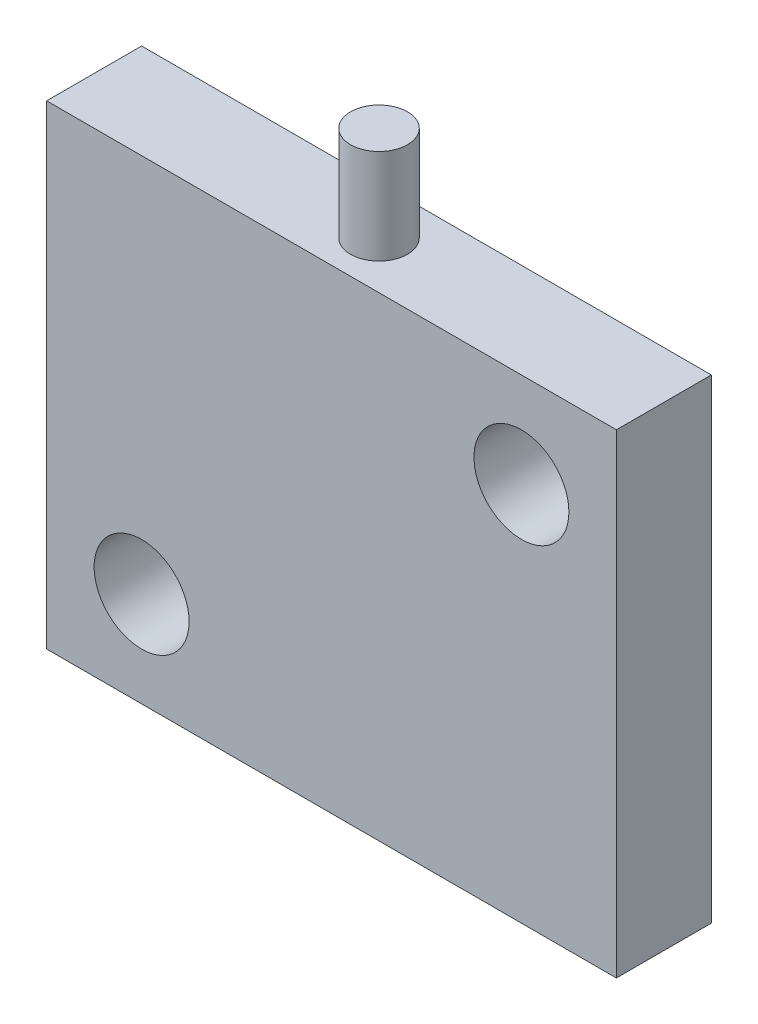
from build123d import *

# Parameters (mm, degrees)
SKETCH_1_W          = 60
SKETCH_1_H          = 60
EXTRUDE_1_DEPTH     = 10
SKETCH_2_W          = 60
SKETCH_2_H          = 10
SKETCH_2_R          = 3
CUT_EXTRUDE_1_DEPTH = 10
SKETCH_3_R          = 5
CUT_EXTRUDE_2_DEPTH = 44.588989435


with BuildPart() as part:
    # 草图1 → 凸台-拉伸1 (new body)
    with BuildSketch(Plane.XY):
        Rectangle(SKETCH_1_W, SKETCH_1_H)
    extrude(amount=EXTRUDE_1_DEPTH)

    # 草图2 → 切除-拉伸1 (cut)
    with BuildSketch(Plane(origin=(0, 30, 0), x_dir=(1, 0, 0), z_dir=(0, 1, 0))):
        with Locations((0, -5)):
            Rectangle(SKETCH_2_W, SKETCH_2_H)
        with Locations(Location((0, -5, 0), (0, 0, 270))):
            Circle(SKETCH_2_R, mode=Mode.SUBTRACT)
    extrude(amount=-CUT_EXTRUDE_1_DEPTH, mode=Mode.SUBTRACT)

    # 草图3 → 切除-拉伸2 (cut, through all)
    with BuildSketch(Plane.XY.offset(10)):
        with Locations((-20, -20)):
            Circle(SKETCH_3_R)
        with Locations((20, 10)):
            Circle(SKETCH_3_R)
    extrude(amount=-CUT_EXTRUDE_2_DEPTH, mode=Mode.SUBTRACT)


solid = part.part
